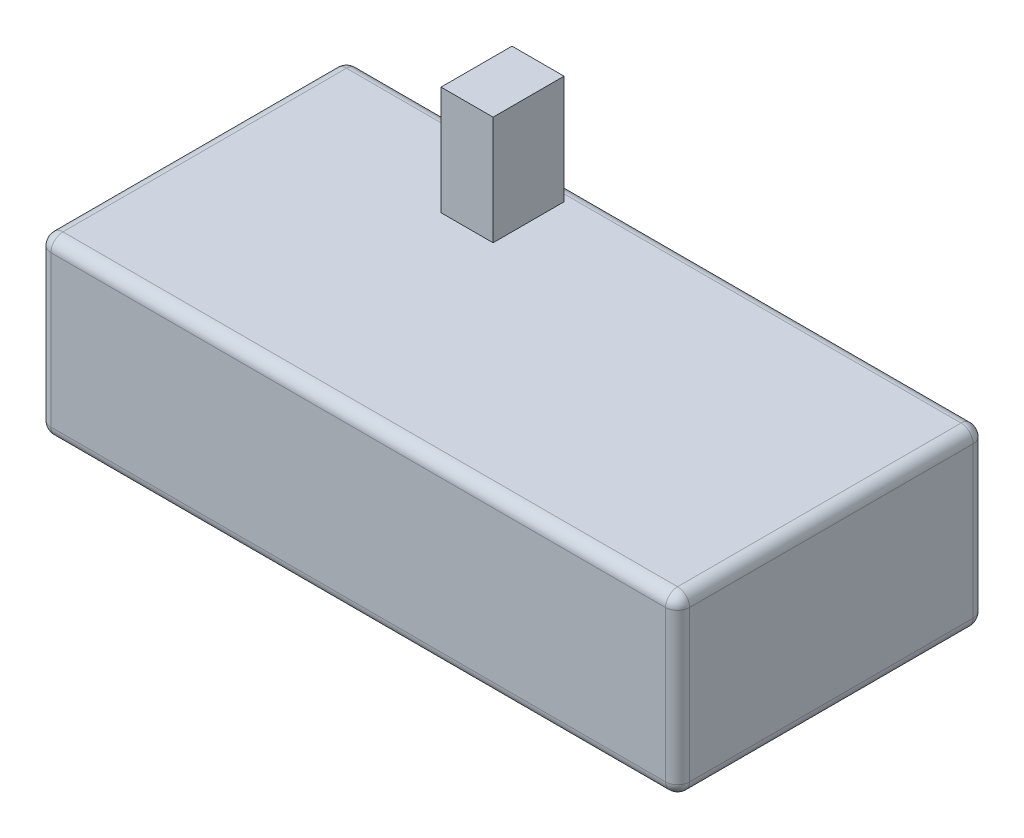
from build123d import *

# Parameters (mm, degrees)
SKETCH1_W           = 135
SKETCH1_H           = 65
BOSS_EXTRUDE1_DEPTH = 37
FILLET1_R           = 2.54
SKETCH2_W           = 11
SKETCH2_H           = 15
BOSS_EXTRUDE2_DEPTH = 23
SKETCH3_W           = 13
SKETCH3_H           = 4
BOSS_EXTRUDE3_DEPTH = 10
SKETCH4_W           = 5
SKETCH4_H           = 5
CUT_EXTRUDE1_DEPTH  = 158.334039546


with BuildPart() as part:
    # Sketch1 → Boss-Extrude1 (new body)
    with BuildSketch(Plane(origin=(0, 0, 0), x_dir=(1, 0, 0), z_dir=(0, 1, 0))):
        with Locations((67.5, -32.5)):
            Rectangle(SKETCH1_W, SKETCH1_H)
    extrude(amount=BOSS_EXTRUDE1_DEPTH)

    # Fillet1
    fillet1_edges = [part.edges().sort_by_distance(p)[0] for p in [
        (135, 37, 32.5),
        (67.5, 37, 0),
        (0, 37, 32.5),
        (67.5, 0, 0),
        (135, 0, 32.5),
        (67.5, 0, 65),
        (0, 0, 32.5),
        (67.5, 37, 65),
        (0, 18.5, 0),
        (135, 18.5, 0),
        (135, 18.5, 65),
        (0, 18.5, 65),
    ]]
    fillet(fillet1_edges, radius=FILLET1_R)

    # Sketch2 → Boss-Extrude2 (add)
    with BuildSketch(Plane(origin=(0, 37, 0), x_dir=(1, 0, 0), z_dir=(0, 1, 0))):
        with Locations((44.5, -11.5)):
            Rectangle(SKETCH2_W, SKETCH2_H)
    extrude(amount=BOSS_EXTRUDE2_DEPTH)

    # Sketch3 → Boss-Extrude3 (add)
    with BuildSketch(Plane(origin=(0, 0, 0), x_dir=(-1, 0, 0), z_dir=(0, 0, -1))):
        with Locations((-59.5, 10)):
            Rectangle(SKETCH3_W, SKETCH3_H)
    extrude(amount=BOSS_EXTRUDE3_DEPTH)

    # Sketch4 → Cut-Extrude1 (cut, through all)
    with BuildSketch(Plane(origin=(0, 12, 0), x_dir=(1, 0, 0), z_dir=(0, 1, 0))):
        with Locations((59.5, 5.5)):
            Rectangle(SKETCH4_W, SKETCH4_H)
    extrude(amount=-CUT_EXTRUDE1_DEPTH, mode=Mode.SUBTRACT)


solid = part.part
